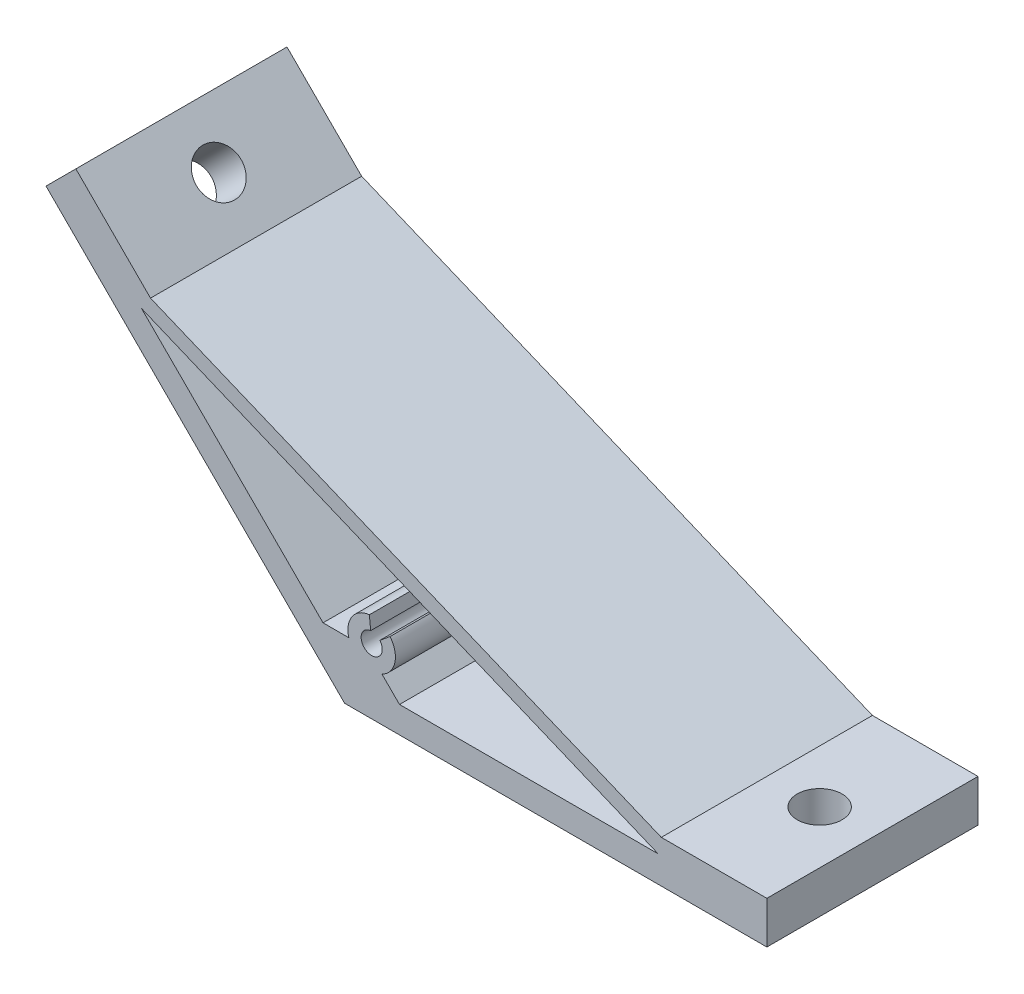
from build123d import *

# Parameters (mm, degrees)
EXTRUDE_1_DEPTH         = 20
HOLE_WIZARD_8_5_8_5_1_D = 8.5
HOLE_WIZARD_8_5_8_5_2_D = 8.5


with BuildPart() as part:
    # 草图1 → 凸台-拉伸1 (new, symmetric)
    with BuildSketch(Plane.XY):
        Polygon((6936.119122288, -1232.086390659), (6992.687664783, -1288.654933154), (7072.687664783, -1288.654933154), (7072.687664783, -1280.654933154), (7052.687664783, -1280.654933154), (6955.918112162, -1240.571672033), (6941.775976538, -1226.429536409), align=None)
        with BuildLine():
            Line((7009.090927681, -1283.654933154), (7003.090927681, -1283.654933154))
            Line((7003.090927681, -1283.654933154), (6999.760549745, -1280.324555218))
            ThreePointArc((6999.760549745, -1280.324555218), (7002.213755914, -1277.239517812), (7001.296666197, -1273.406161221))
            Line((7001.296666197, -1273.406161221), (6999.365595427, -1274.993916141))
            ThreePointArc((6999.365595427, -1274.993916141), (6997.055371947, -1278.111879141), (6997.626530039, -1274.273571671))
            Line((6997.626530039, -1274.273571671), (6997.383769074, -1271.785386165))
            ThreePointArc((6997.383769074, -1271.785386165), (6994.101203016, -1273.731324494), (6993.49338103, -1277.49861375))
            Line((6993.49338103, -1277.49861375), (6988.602413191, -1277.49861375))
            Line((6988.602413191, -1277.49861375), (6954.21874867, -1243.114949228))
            Line((6954.21874867, -1243.114949228), (7052.090927681, -1283.654933154))
            Line((7052.090927681, -1283.654933154), (7029.403393536, -1283.654933154))
            Line((7029.403393536, -1283.654933154), (7009.090927681, -1283.654933154))
        make_face(mode=Mode.SUBTRACT)
    extrude(amount=EXTRUDE_1_DEPTH, both=True)

    # Ø8.5 (8.5) 直径孔1 (through all)
    with Locations(Plane(origin=(2852.016365815, 2852.016365815, 0), x_dir=(0.7071067811865628, -0.7071067811865324, 0), z_dir=(-0.7071067811865324, -0.7071067811865628, 0))):
        with Locations((5785.79350833, 0)):
            Hole(HOLE_WIZARD_8_5_8_5_1_D / 2)

    # Ø8.5 (8.5) 直径孔2 (through all)
    with Locations(Plane.XZ.offset(1288.654933154)):
        with Locations((7062.687664783, 0)):
            Hole(HOLE_WIZARD_8_5_8_5_2_D / 2)


solid = part.part
